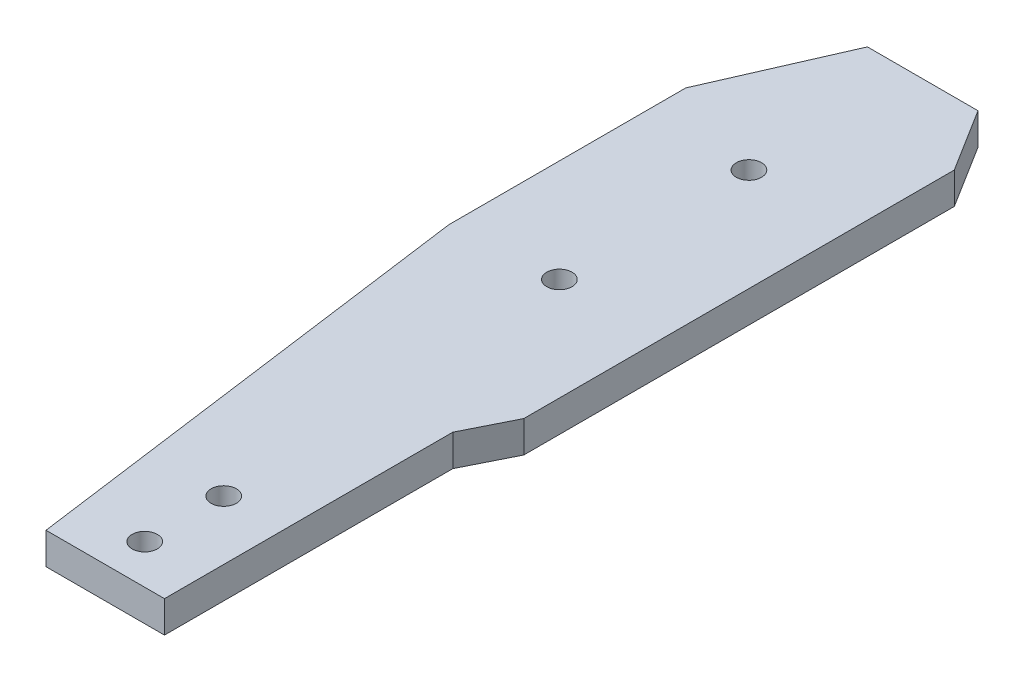
from build123d import *

# Parameters (mm, degrees)
BOSS_EXTRUDE1_DEPTH = 4
SKETCH2_R           = 1.6
CUT_EXTRUDE1_DEPTH  = 4


with BuildPart() as part:
    # Sketch1 → Boss-Extrude1 (new body)
    with BuildSketch(Plane(origin=(0, 0, 0), x_dir=(1, 0, 0), z_dir=(0, 1, 0))):
        Polygon((-7, -16), (-7, -46), (1, -105), (16, -105), (16, -68.5), (19, -62.5), (19, -8), (14, 0), (0, 0), align=None)
    extrude(amount=BOSS_EXTRUDE1_DEPTH)

    # Sketch2 → Cut-Extrude1 (cut)
    with BuildSketch(Plane(origin=(0, 4, 0), x_dir=(1, 0, 0), z_dir=(0, 1, 0))):
        with Locations(Location((6, -21, 0), (0, 0, 270))):
            Circle(SKETCH2_R)
        with Locations(Location((6, -45, 0), (0, 0, 270))):
            Circle(SKETCH2_R)
        with Locations(Location((8.5, -90, 0), (0, 0, 270))):
            Circle(SKETCH2_R)
        with Locations(Location((8.5, -100, 0), (0, 0, 270))):
            Circle(SKETCH2_R)
    extrude(amount=-CUT_EXTRUDE1_DEPTH, mode=Mode.SUBTRACT)


solid = part.part
